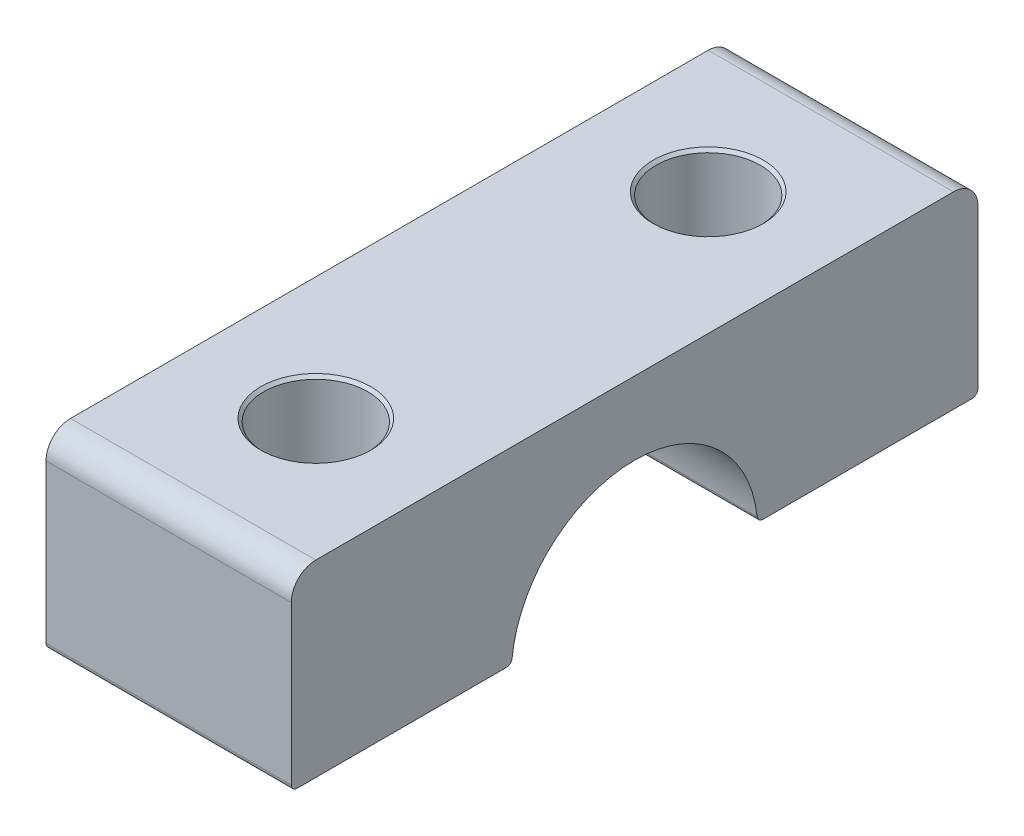
from build123d import *

# Parameters (mm, degrees)
BASE_EXTRUDE_DEPTH = 15.875
SKETCH2_R          = 6.746875
CUT_EXTRUDE1_DEPTH = 54.126241924
CHAMFER1_SIZE      = 0.381


with BuildPart() as part:
    # Sketch1 → Base-Extrude (new, symmetric)
    with BuildSketch(Plane(origin=(0, 0, 0), x_dir=(0, 0, -1), z_dir=(1, 0, 0))):
        with BuildLine():
            Line((16.618356424, 1.016), (43.688, 1.016))
            ThreePointArc((43.688, 1.016), (44.226815367, 1.239184633), (44.45, 1.778))
            Line((44.45, 1.778), (44.45, 22.225))
            ThreePointArc((44.45, 22.225), (43.52006403, 24.47006403), (41.275, 25.4))
            Line((41.275, 25.4), (-41.275, 25.4))
            ThreePointArc((-41.275, 25.4), (-43.52006403, 24.47006403), (-44.45, 22.225))
            Line((-44.45, 22.225), (-44.45, 1.778))
            ThreePointArc((-44.45, 1.778), (-44.226815367, 1.239184633), (-43.688, 1.016))
            Line((-43.688, 1.016), (-16.618356424, 1.016))
            ThreePointArc((-16.618356424, 1.016), (-16.109007152, 1.21124845), (-15.860680599, 1.69693617))
            ThreePointArc((-15.860680599, 1.69693617), (0, 15.9512), (15.860680599, 1.69693617))
            ThreePointArc((15.860680599, 1.69693617), (16.109007152, 1.21124845), (16.618356424, 1.016))
        make_face()
    extrude(amount=BASE_EXTRUDE_DEPTH, both=True)

    # Sketch2 → Cut-Extrude1 (cut, through all)
    with BuildSketch(Plane(origin=(0, 25.4, 0), x_dir=(-1, 0, 0), z_dir=(0, 1, 0))):
        with Locations(Location((0, 25.4, 0), (0, 0, 90))):
            Circle(SKETCH2_R)
        with Locations(Location((0, -25.4, 0), (0, 0, 90))):
            Circle(SKETCH2_R)
    extrude(amount=-CUT_EXTRUDE1_DEPTH, mode=Mode.SUBTRACT)

    # Chamfer1
    chamfer1_edges = [part.edges().sort_by_distance(p)[0] for p in [
        (0, 1.016, 18.653125),
        (0, 25.4, 18.653125),
        (0, 1.016, -32.146875),
        (0, 25.4, -32.146875),
    ]]
    chamfer(chamfer1_edges, length=CHAMFER1_SIZE)


solid = part.part
